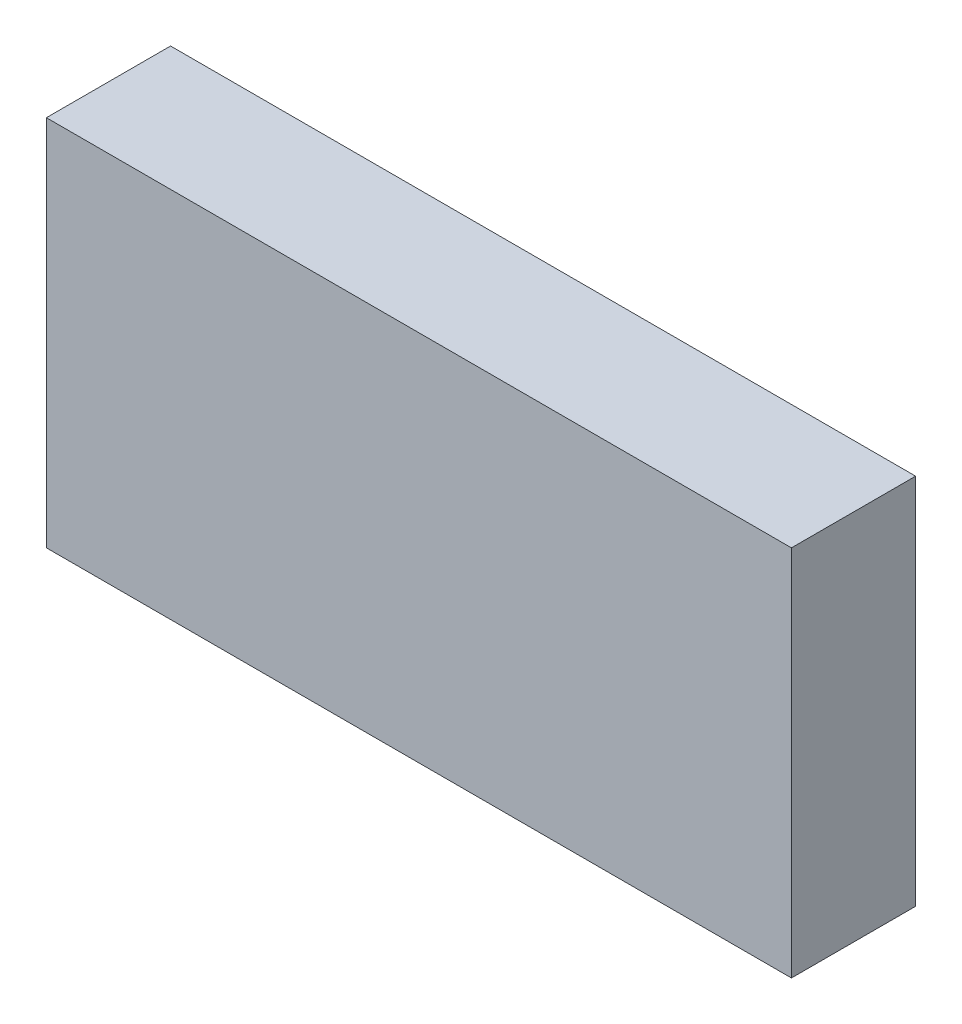
from build123d import *

# Parameters (mm, degrees)
SKETCH_1_W      = 120
SKETCH_1_H      = 60
EXTRUDE_1_DEPTH = 20


with BuildPart() as part:
    # 草图1 → 凸台-拉伸1 (new body)
    with BuildSketch(Plane.XY):
        Rectangle(SKETCH_1_W, SKETCH_1_H)
    extrude(amount=EXTRUDE_1_DEPTH)


solid = part.part
